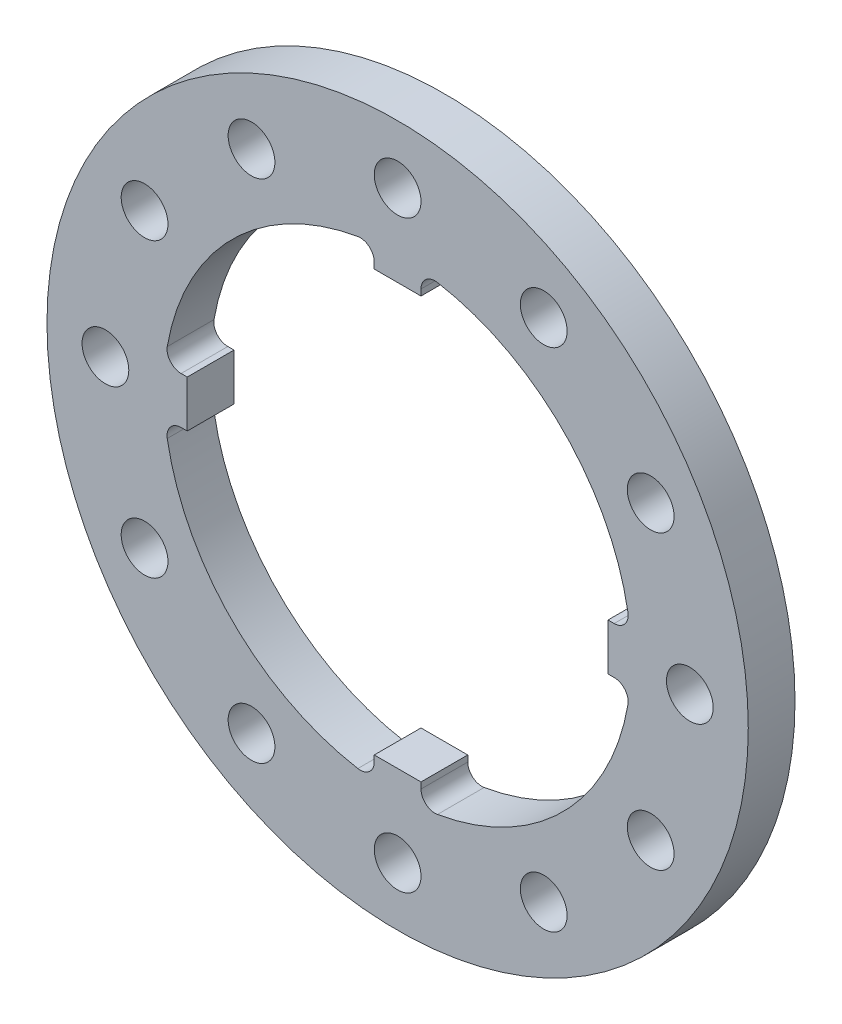
from build123d import *

# Parameters (mm, degrees)
SKETCH1_R           = 75
SKETCH1_R_2         = 5
BOSS_EXTRUDE1_DEPTH = 5


with BuildPart() as part:
    # Sketch1 → Boss-Extrude1 (new, symmetric)
    with BuildSketch(Plane.XY):
        Circle(SKETCH1_R)
        with Locations((62.5, 0)):
            Circle(SKETCH1_R_2, mode=Mode.SUBTRACT)
        with Locations((54.126587737, -31.25)):
            Circle(SKETCH1_R_2, mode=Mode.SUBTRACT)
        with Locations((31.25, -54.126587737)):
            Circle(SKETCH1_R_2, mode=Mode.SUBTRACT)
        with Locations((0, -62.5)):
            Circle(SKETCH1_R_2, mode=Mode.SUBTRACT)
        with Locations((-31.25, -54.126587737)):
            Circle(SKETCH1_R_2, mode=Mode.SUBTRACT)
        with Locations((-54.126587737, -31.25)):
            Circle(SKETCH1_R_2, mode=Mode.SUBTRACT)
        with Locations((-62.5, 0)):
            Circle(SKETCH1_R_2, mode=Mode.SUBTRACT)
        with Locations((-54.126587737, 31.25)):
            Circle(SKETCH1_R_2, mode=Mode.SUBTRACT)
        with Locations((-31.25, 54.126587737)):
            Circle(SKETCH1_R_2, mode=Mode.SUBTRACT)
        with Locations((0, 62.5)):
            Circle(SKETCH1_R_2, mode=Mode.SUBTRACT)
        with Locations((31.25, 54.126587737)):
            Circle(SKETCH1_R_2, mode=Mode.SUBTRACT)
        with Locations((54.126587737, 31.25)):
            Circle(SKETCH1_R_2, mode=Mode.SUBTRACT)
        with BuildLine():
            Line((45, 5), (46.314144708, 5))
            ThreePointArc((46.314144708, 5), (48.608912113, 6.067632914), (49.27036671, 8.510638298))
            ThreePointArc((49.27036671, 8.510638298), (35.355339059, 35.355339059), (8.510638298, 49.27036671))
            ThreePointArc((8.510638298, 49.27036671), (6.067632914, 48.608912113), (5, 46.314144708))
            Line((5, 46.314144708), (5, 45))
            Line((5, 45), (-5, 45))
            Line((-5, 45), (-5, 46.314144708))
            ThreePointArc((-5, 46.314144708), (-6.067632914, 48.608912113), (-8.510638298, 49.27036671))
            ThreePointArc((-8.510638298, 49.27036671), (-35.355339059, 35.355339059), (-49.27036671, 8.510638298))
            ThreePointArc((-49.27036671, 8.510638298), (-48.608912113, 6.067632914), (-46.314144708, 5))
            Line((-46.314144708, 5), (-45, 5))
            Line((-45, 5), (-45, -5))
            Line((-45, -5), (-46.314144708, -5))
            ThreePointArc((-46.314144708, -5), (-48.608912113, -6.067632914), (-49.27036671, -8.510638298))
            ThreePointArc((-49.27036671, -8.510638298), (-35.355339059, -35.355339059), (-8.510638298, -49.27036671))
            ThreePointArc((-8.510638298, -49.27036671), (-6.067632914, -48.608912113), (-5, -46.314144708))
            Line((-5, -46.314144708), (-5, -45))
            Line((-5, -45), (5, -45))
            Line((5, -45), (5, -46.314144708))
            ThreePointArc((5, -46.314144708), (6.067632914, -48.608912113), (8.510638298, -49.27036671))
            ThreePointArc((8.510638298, -49.27036671), (35.355339059, -35.355339059), (49.27036671, -8.510638298))
            ThreePointArc((49.27036671, -8.510638298), (48.608912113, -6.067632914), (46.314144708, -5))
            Line((46.314144708, -5), (45, -5))
            Line((45, -5), (45, 5))
        make_face(mode=Mode.SUBTRACT)
    extrude(amount=BOSS_EXTRUDE1_DEPTH, both=True)


solid = part.part
